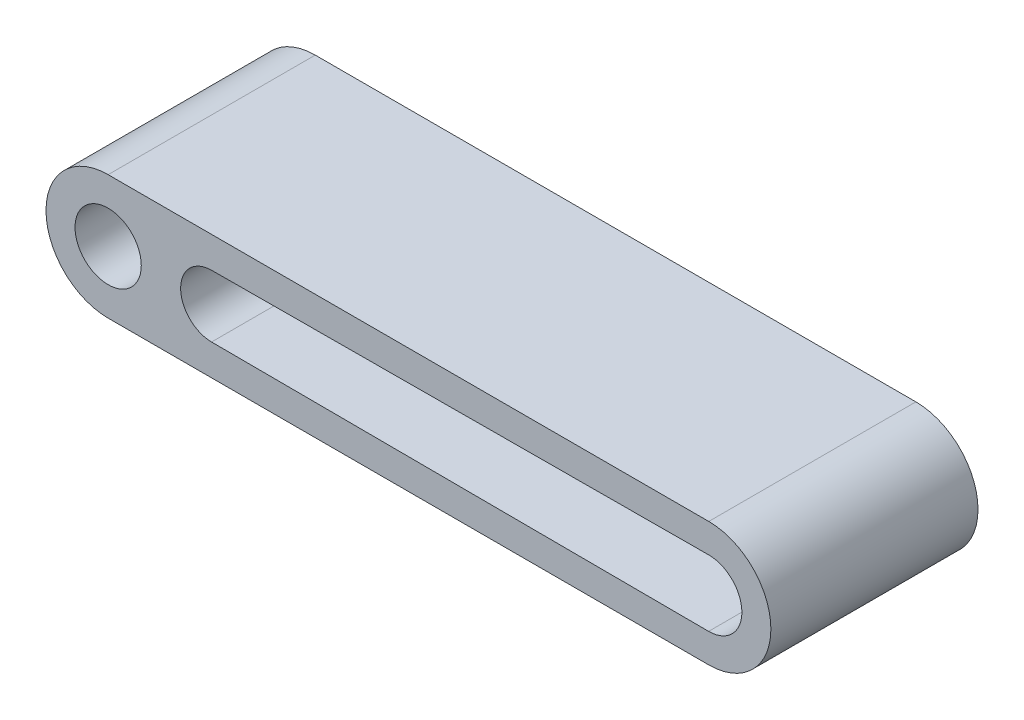
from build123d import *

# Parameters (mm, degrees)
CROQUIS1_R              = 1.6
SALIENTE_EXTRUIR1_DEPTH = 10


with BuildPart() as part:
    # Croquis1 → Saliente-Extruir1 (new body)
    with BuildSketch(Plane.XY):
        with BuildLine():
            Line((0, 3), (29.000208332, 3))
            ThreePointArc((29.000208332, 3), (32.000208332, 0), (29.000208332, -3))
            Line((29.000208332, -3), (0, -3))
            ThreePointArc((0, -3), (-3, 0), (0, 3))
        make_face()
        Circle(CROQUIS1_R, mode=Mode.SUBTRACT)
        with BuildLine():
            Line((4.993750054, 1.499986979), (28.993541724, 1.599986111))
            ThreePointArc((28.993541724, 1.599986111), (30.600208332, 0), (28.993541724, -1.599986111))
            Line((28.993541724, -1.599986111), (4.993750054, -1.499986979))
            ThreePointArc((4.993750054, -1.499986979), (3.5, 0), (4.993750054, 1.499986979))
        make_face(mode=Mode.SUBTRACT)
    extrude(amount=SALIENTE_EXTRUIR1_DEPTH)


solid = part.part
